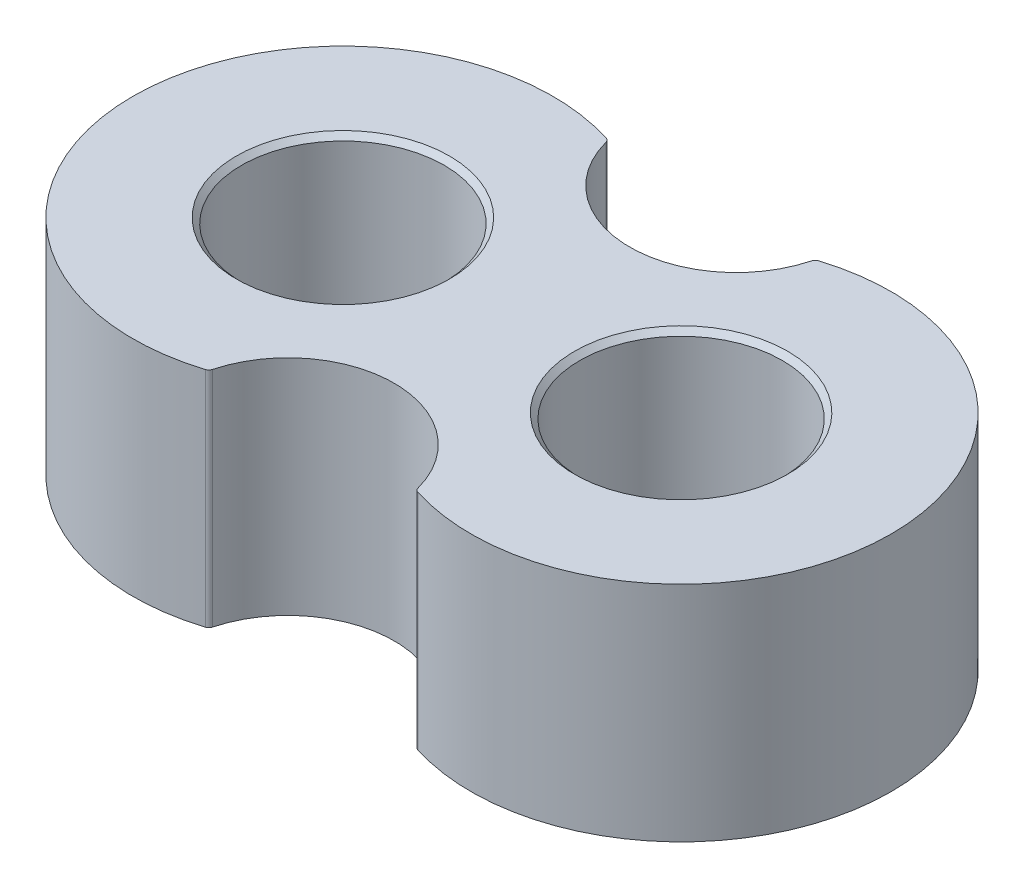
from build123d import *

# Parameters (mm, degrees)
SKETCH1_R           = 9.525
BOSS_EXTRUDE1_DEPTH = 20.985
CHAMFER1_SIZE       = 0.5


with BuildPart() as part:
    # Sketch1 → Boss-Extrude1 (new body)
    with BuildSketch(Plane(origin=(0, 0, 0), x_dir=(1, 0, 0), z_dir=(0, 1, 0))):
        with BuildLine():
            ThreePointArc((-9.662407992, 18.498593241), (0, 11.075), (9.662407992, 18.498593241))
            ThreePointArc((9.662407992, 18.498593241), (9.784456714, 18.715644618), (9.996061597, 18.846909862))
            ThreePointArc((9.996061597, 18.846909862), (35.65, 0), (9.996061597, -18.846909862))
            ThreePointArc((9.996061597, -18.846909862), (9.784456714, -18.715644618), (9.662407992, -18.498593241))
            ThreePointArc((9.662407992, -18.498593241), (0, -11.075), (-9.662407992, -18.498593241))
            ThreePointArc((-9.662407992, -18.498593241), (-9.784456714, -18.715644618), (-9.996061597, -18.846909862))
            ThreePointArc((-9.996061597, -18.846909862), (-35.65, 0), (-9.996061597, 18.846909862))
            ThreePointArc((-9.996061597, 18.846909862), (-9.784456714, 18.715644618), (-9.662407992, 18.498593241))
        make_face()
        with Locations(Location((-15.9, 0, 0), (0, 0, 270))):
            Circle(SKETCH1_R, mode=Mode.SUBTRACT)
        with Locations(Location((15.9, 0, 0), (0, 0, 270))):
            Circle(SKETCH1_R, mode=Mode.SUBTRACT)
    extrude(amount=BOSS_EXTRUDE1_DEPTH)

    # Chamfer1
    chamfer1_edges = [part.edges().sort_by_distance(p)[0] for p in [
        (-15.9, 0, -9.525),
        (-15.9, 20.985, -9.525),
        (15.9, 0, -9.525),
        (15.9, 20.985, -9.525),
    ]]
    chamfer(chamfer1_edges, length=CHAMFER1_SIZE)


solid = part.part
